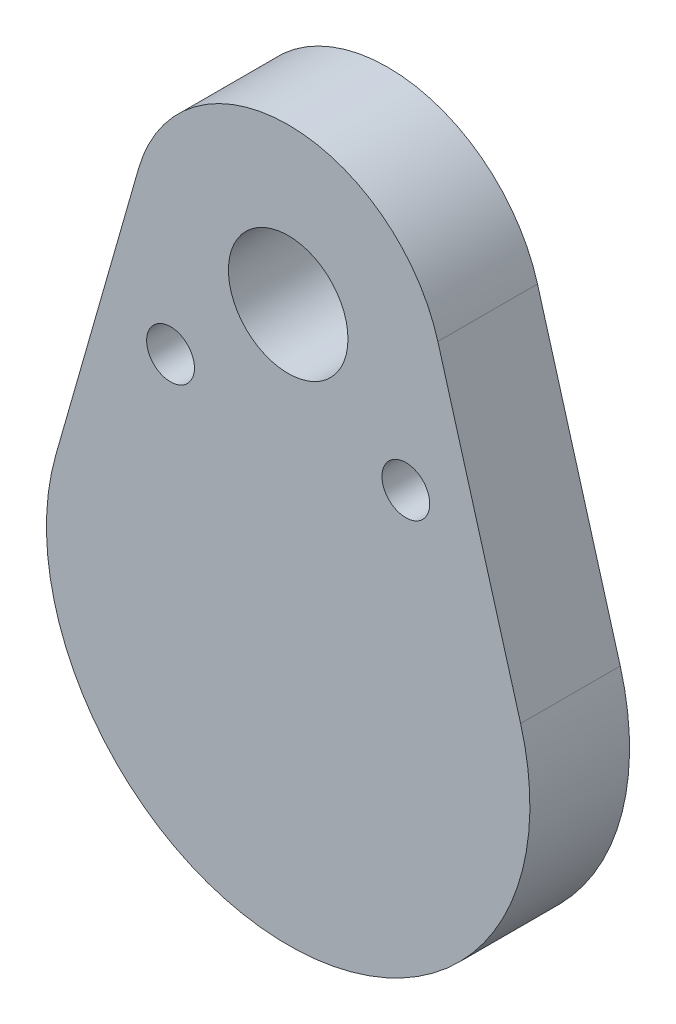
from build123d import *

# Parameters (mm, degrees)
ESQUISSE1_R        = 3
ESQUISSE1_R_2      = 1.2
BOSS_EXTRU_1_DEPTH = 5


with BuildPart() as part:
    # Esquisse1 → Boss.-Extru.1 (new body)
    with BuildSketch(Plane.XY):
        with BuildLine():
            Line((7.511654648, 17.86120118), (11.664614312, 3.334802688))
            ThreePointArc((11.664614312, 3.334802688), (0, -12.131946918), (-11.664614312, 3.334802688))
            Line((-11.664614312, 3.334802688), (-7.511654648, 17.86120118))
            ThreePointArc((-7.511654648, 17.86120118), (0, 23.526292848), (7.511654648, 17.86120118))
        make_face()
        with Locations((0, 15.713690304)):
            Circle(ESQUISSE1_R, mode=Mode.SUBTRACT)
        with Locations((5.904785434, 10.598001934)):
            Circle(ESQUISSE1_R_2, mode=Mode.SUBTRACT)
        with Locations((-5.904785434, 10.598001934)):
            Circle(ESQUISSE1_R_2, mode=Mode.SUBTRACT)
    extrude(amount=BOSS_EXTRU_1_DEPTH)


solid = part.part
